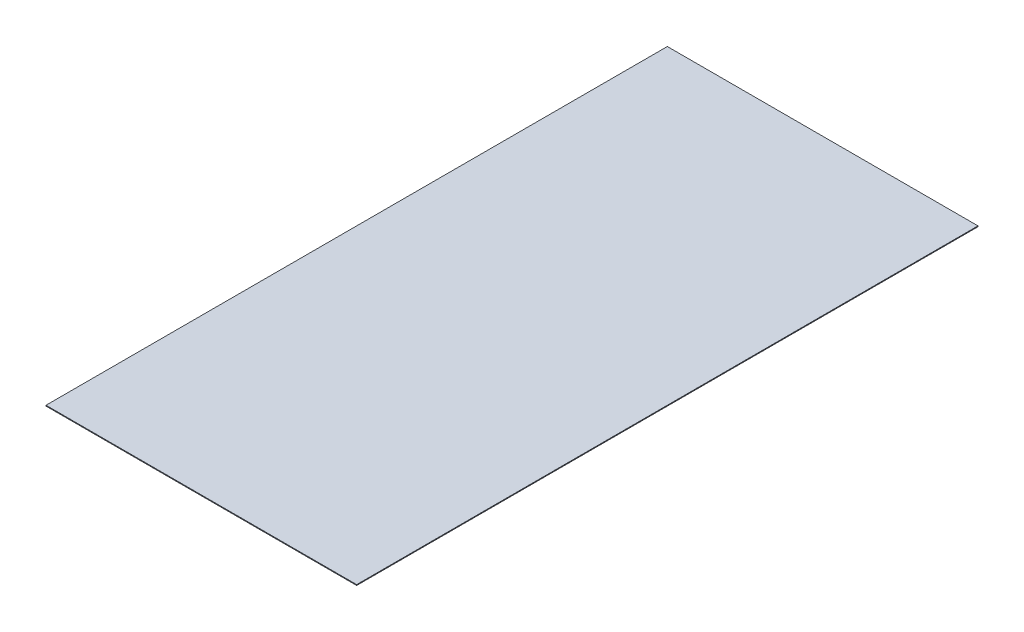
from build123d import *

# Parameters (mm, degrees)
SKETCH1_W           = 400
SKETCH1_H           = 800
BOSS_EXTRUDE1_DEPTH = 1


with BuildPart() as part:
    # Sketch1 → Boss-Extrude1 (new body)
    with BuildSketch(Plane(origin=(0, 0, 0), x_dir=(1, 0, 0), z_dir=(0, 1, 0))):
        with Locations((200, 400)):
            Rectangle(SKETCH1_W, SKETCH1_H)
    extrude(amount=BOSS_EXTRUDE1_DEPTH)


solid = part.part
